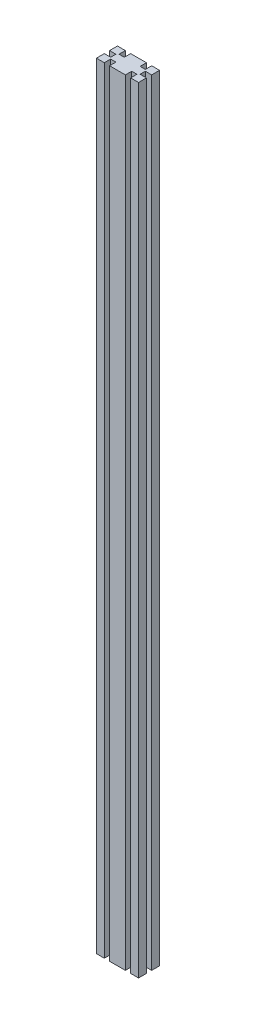
from build123d import *

# Parameters (mm, degrees)
BOSS_EXTRUDE1_DEPTH      = 368.3
BOSS_EXTRUDE1_DEPTH_BACK = 368.3
SKETCH1_W                = 40
SKETCH1_H                = 20
CUT_EXTRUDE1_DEPTH       = 369.978170086
CUT_EXTRUDE1_DEPTH_BACK  = 369.978170086
SKETCH2_W                = 5
SKETCH2_H                = 12
SKETCH2_W_2              = 12
SKETCH2_H_2              = 5


with BuildPart() as part:
    # Sketch1 → Boss-Extrude1 (new, two sides: drawn at the far end of the back side and taken through both)
    with BuildSketch(Plane(origin=(0, 0, 0), x_dir=(1, 0, 0), z_dir=(0, 1, 0)).offset(-BOSS_EXTRUDE1_DEPTH_BACK)):
        Rectangle(SKETCH1_W, SKETCH1_H)
    extrude(amount=BOSS_EXTRUDE1_DEPTH + BOSS_EXTRUDE1_DEPTH_BACK)

    # Sketch2 → Cut-Extrude1 (cut, two sides: drawn at the far end of the back side and taken through both)
    with BuildSketch(Plane(origin=(0, 0, 0), x_dir=(1, 0, 0), z_dir=(0, 1, 0)).offset(-CUT_EXTRUDE1_DEPTH_BACK)):
        with Locations((-10, 10)):
            Rectangle(SKETCH2_W, SKETCH2_H)
        with Locations((-10, -10)):
            Rectangle(SKETCH2_W, SKETCH2_H)
        with Locations((-20, 0)):
            Rectangle(SKETCH2_W_2, SKETCH2_H_2)
        with Locations((10, 10)):
            Rectangle(SKETCH2_W, SKETCH2_H)
        with Locations((20, 0)):
            Rectangle(SKETCH2_W_2, SKETCH2_H_2)
        with Locations((10, -10)):
            Rectangle(SKETCH2_W, SKETCH2_H)
    extrude(amount=CUT_EXTRUDE1_DEPTH + CUT_EXTRUDE1_DEPTH_BACK, mode=Mode.SUBTRACT)


solid = part.part
